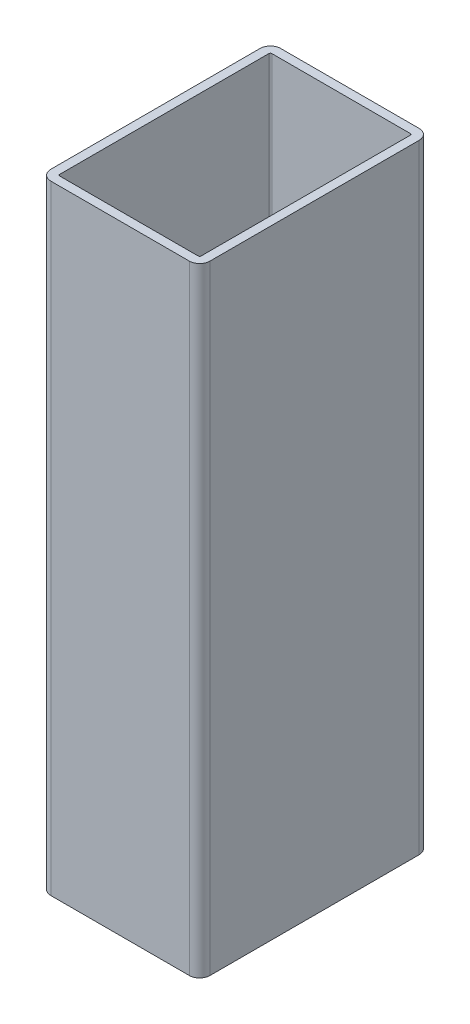
from build123d import *

# Parameters (mm, degrees)
RHS_RHS90X50X5_1_DEPTH = 700


with BuildPart() as part:
    # Sketch11 → Rhs RHS90X50X5(1) (new body)
    with BuildSketch(Plane(origin=(0, 0, 0), x_dir=(-1, 0, 0), z_dir=(0, 1, 0))):
        with BuildLine():
            Line((-78.333333333, -130), (78.333333333, -130))
            ThreePointArc((78.333333333, -130), (86.582912447, -126.582912447), (90, -118.333333333))
            Line((90, -118.333333333), (90, 118.333333333))
            ThreePointArc((90, 118.333333333), (86.582912447, 126.582912447), (78.333333333, 130))
            Line((78.333333333, 130), (-78.333333333, 130))
            ThreePointArc((-78.333333333, 130), (-86.582912447, 126.582912447), (-90, 118.333333333))
            Line((-90, 118.333333333), (-90, -118.333333333))
            ThreePointArc((-90, -118.333333333), (-86.582912447, -126.582912447), (-78.333333333, -130))
        make_face()
        with BuildLine():
            Line((-78.333333333, -120), (78.333333333, -120))
            ThreePointArc((78.333333333, -120), (79.511844635, -119.511844635), (80, -118.333333333))
            Line((80, -118.333333333), (80, 118.333333333))
            ThreePointArc((80, 118.333333333), (79.511844635, 119.511844635), (78.333333333, 120))
            Line((78.333333333, 120), (-78.333333333, 120))
            ThreePointArc((-78.333333333, 120), (-79.511844635, 119.511844635), (-80, 118.333333333))
            Line((-80, 118.333333333), (-80, -118.333333333))
            ThreePointArc((-80, -118.333333333), (-79.511844635, -119.511844635), (-78.333333333, -120))
        make_face(mode=Mode.SUBTRACT)
    extrude(amount=RHS_RHS90X50X5_1_DEPTH)


solid = part.part
